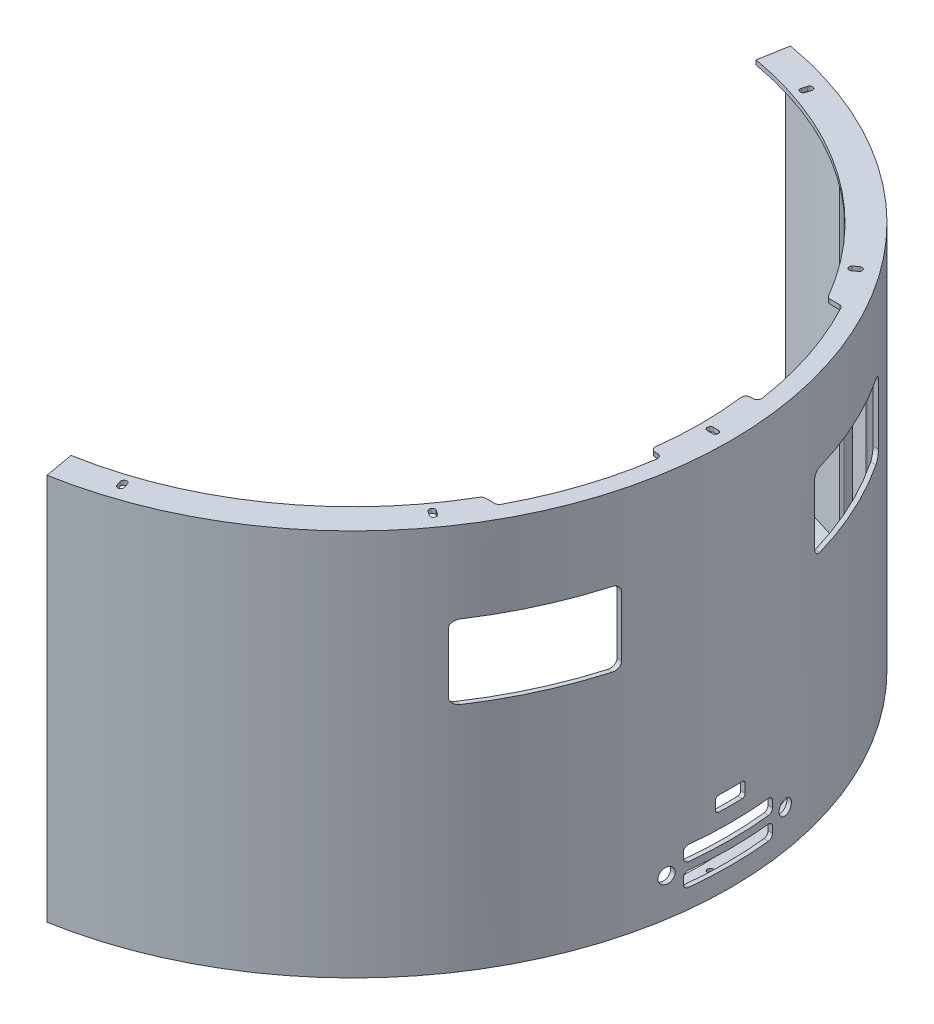
from build123d import *

# Parameters (mm, degrees)
BOSS_EXTRUDE1_DEPTH   = 255
BOSS_EXTRUDE2_DEPTH   = 255
BOSS_EXTRUDE2_2_DEPTH = 255
BOSS_EXTRUDE2_3_DEPTH = 255
BOSS_EXTRUDE2_4_DEPTH = 255
BOSS_EXTRUDE2_5_DEPTH = 255
BOSS_EXTRUDE2_6_DEPTH = 255
BOSS_EXTRUDE2_7_DEPTH = 255
BOSS_EXTRUDE2_8_DEPTH = 255
BOSS_EXTRUDE3_DEPTH   = 3
CUT_EXTRUDE3_DEPTH    = 5
LPATTERN1_COUNT       = 2
LPATTERN1_PITCH       = 258
LPATTERN2_COUNT       = 2
LPATTERN2_PITCH       = 258
CUT_EXTRUDE7_DEPTH    = 324
CUT_EXTRUDE10_DEPTH   = 5
FILLET2_R             = 3
CUT_EXTRUDE11_DEPTH   = 317
SKETCH15_R            = 5
CUT_EXTRUDE12_DEPTH   = 368


with BuildPart() as part:
    # Sketch3 → Boss-Extrude1 (new body)
    with BuildSketch(Plane(origin=(0, 0, 0), x_dir=(1, 0, 0), z_dir=(0, 1, 0))):
        with BuildLine():
            ThreePointArc((0, -254.5), (-22.181136529, -253.531550664), (-44.193461216, -250.633573142))
            Line((-44.193461216, -250.633573142), (-43.672516683, -247.679149883))
            ThreePointArc((-43.672516683, -247.679149883), (-21.919669301, -250.54296657), (0, -251.5))
            ThreePointArc((0, -251.5), (251.5, 0), (0, 251.5))
            ThreePointArc((0, 251.5), (-21.919669301, 250.54296657), (-43.672516683, 247.679149883))
            Line((-43.672516683, 247.679149883), (-44.193461216, 250.633573142))
            ThreePointArc((-44.193461216, 250.633573142), (-22.181136529, 253.531550664), (0, 254.5))
            ThreePointArc((0, 254.5), (254.5, 0), (0, -254.5))
        make_face()
    extrude(amount=BOSS_EXTRUDE1_DEPTH)


with BuildPart() as body_2:
    # Sketch6 → Boss-Extrude2 (new body)
    with BuildSketch(Plane(origin=(0, 255, 0), x_dir=(1, 0, 0), z_dir=(0, 1, 0))):
        with BuildLine():
            Line((-2, -253.081926056), (2, -253.081926056))
            Line((2, -253.081926056), (2, -247.081926056))
            ThreePointArc((2, -247.081926056), (1.707106781, -246.374819275), (1, -246.081926056))
            Line((1, -246.081926056), (-1, -246.081926056))
            ThreePointArc((-1, -246.081926056), (-1.707106781, -246.374819275), (-2, -247.081926056))
            Line((-2, -247.081926056), (-2, -253.081926056))
        make_face()
    extrude(amount=-BOSS_EXTRUDE2_DEPTH)


with BuildPart() as body_3:
    # Sketch6 → Boss-Extrude2 2 (new body)
    with BuildSketch(Plane(origin=(0, 255, 0), x_dir=(1, 0, 0), z_dir=(0, 1, 0))):
        with BuildLine():
            Line((-1, 246.081926056), (1, 246.081926056))
            ThreePointArc((1, 246.081926056), (1.707106781, 246.374819275), (2, 247.081926056))
            Line((2, 247.081926056), (2, 253.081926056))
            Line((2, 253.081926056), (-2, 253.081926056))
            Line((-2, 253.081926056), (-2, 247.081926056))
            ThreePointArc((-2, 247.081926056), (-1.707106781, 246.374819275), (-1, 246.081926056))
        make_face()
    extrude(amount=-BOSS_EXTRUDE2_2_DEPTH)


with BuildPart() as body_4:
    # Sketch6 → Boss-Extrude2 3 (new body)
    with BuildSketch(Plane(origin=(0, 255, 0), x_dir=(1, 0, 0), z_dir=(0, 1, 0))):
        with BuildLine():
            Line((111.610070116, 227.151168927), (108.006194645, 228.886703884))
            Line((108.006194645, 228.886703884), (105.40289221, 223.480890676))
            ThreePointArc((105.40289221, 223.480890676), (105.359977747, 222.716727875), (105.869977339, 222.146038069))
            Line((105.869977339, 222.146038069), (107.671915074, 221.278270591))
            ThreePointArc((107.671915074, 221.278270591), (108.436077876, 221.235356129), (109.006767681, 221.74535572))
            Line((109.006767681, 221.74535572), (111.610070116, 227.151168927))
        make_face()
    extrude(amount=-BOSS_EXTRUDE2_3_DEPTH)


with BuildPart() as body_5:
    # Sketch6 → Boss-Extrude2 4 (new body)
    with BuildSketch(Plane(origin=(0, 255, 0), x_dir=(1, 0, 0), z_dir=(0, 1, 0))):
        with BuildLine():
            Line((199.114397038, 156.230336966), (196.620437831, 159.357662896))
            Line((196.620437831, 159.357662896), (191.929448936, 155.616724085))
            ThreePointArc((191.929448936, 155.616724085), (191.559226528, 154.946857078), (191.771107255, 154.2114028))
            Line((191.771107255, 154.2114028), (193.018086859, 152.647739835))
            ThreePointArc((193.018086859, 152.647739835), (193.687953865, 152.277517427), (194.423408143, 152.489398155))
            Line((194.423408143, 152.489398155), (199.114397038, 156.230336966))
        make_face()
    extrude(amount=-BOSS_EXTRUDE2_4_DEPTH)


with BuildPart() as body_6:
    # Sketch6 → Boss-Extrude2 5 (new body)
    with BuildSketch(Plane(origin=(0, 255, 0), x_dir=(1, 0, 0), z_dir=(0, 1, 0))):
        with BuildLine():
            Line((247.181675649, 54.366170729), (246.291591913, 58.265882378))
            Line((246.291591913, 58.265882378), (240.44202444, 56.930756774))
            ThreePointArc((240.44202444, 56.930756774), (239.817821175, 56.487860938), (239.689617462, 55.733307928))
            Line((239.689617462, 55.733307928), (240.13465933, 53.783452104))
            ThreePointArc((240.13465933, 53.783452104), (240.577555165, 53.159248838), (241.332108176, 53.031045125))
            Line((241.332108176, 53.031045125), (247.181675649, 54.366170729))
        make_face()
    extrude(amount=-BOSS_EXTRUDE2_5_DEPTH)


with BuildPart() as body_7:
    # Sketch6 → Boss-Extrude2 6 (new body)
    with BuildSketch(Plane(origin=(0, 255, 0), x_dir=(1, 0, 0), z_dir=(0, 1, 0))):
        with BuildLine():
            Line((246.291591913, -58.265882378), (247.181675649, -54.366170729))
            Line((247.181675649, -54.366170729), (241.332108176, -53.031045125))
            ThreePointArc((241.332108176, -53.031045125), (240.577555165, -53.159248838), (240.13465933, -53.783452104))
            Line((240.13465933, -53.783452104), (239.689617462, -55.733307928))
            ThreePointArc((239.689617462, -55.733307928), (239.817821175, -56.487860938), (240.44202444, -56.930756774))
            Line((240.44202444, -56.930756774), (246.291591913, -58.265882378))
        make_face()
    extrude(amount=-BOSS_EXTRUDE2_6_DEPTH)


with BuildPart() as body_8:
    # Sketch6 → Boss-Extrude2 7 (new body)
    with BuildSketch(Plane(origin=(0, 255, 0), x_dir=(1, 0, 0), z_dir=(0, 1, 0))):
        with BuildLine():
            Line((196.620437831, -159.357662896), (199.114397038, -156.230336966))
            Line((199.114397038, -156.230336966), (194.423408143, -152.489398155))
            ThreePointArc((194.423408143, -152.489398155), (193.687953865, -152.277517427), (193.018086859, -152.647739835))
            Line((193.018086859, -152.647739835), (191.771107255, -154.2114028))
            ThreePointArc((191.771107255, -154.2114028), (191.559226528, -154.946857078), (191.929448936, -155.616724085))
            Line((191.929448936, -155.616724085), (196.620437831, -159.357662896))
        make_face()
    extrude(amount=-BOSS_EXTRUDE2_7_DEPTH)


with BuildPart() as body_9:
    # Sketch6 → Boss-Extrude2 8 (new body)
    with BuildSketch(Plane(origin=(0, 255, 0), x_dir=(1, 0, 0), z_dir=(0, 1, 0))):
        with BuildLine():
            Line((108.006194645, -228.886703884), (111.610070116, -227.151168927))
            Line((111.610070116, -227.151168927), (109.006767681, -221.74535572))
            ThreePointArc((109.006767681, -221.74535572), (108.436077876, -221.235356129), (107.671915074, -221.278270591))
            Line((107.671915074, -221.278270591), (105.869977339, -222.146038069))
            ThreePointArc((105.869977339, -222.146038069), (105.359977747, -222.716727875), (105.40289221, -223.480890676))
            Line((105.40289221, -223.480890676), (108.006194645, -228.886703884))
        make_face()
    extrude(amount=-BOSS_EXTRUDE2_8_DEPTH)


with BuildPart() as body_3_1:
    add(body_3.part)

    # Combine2: union part, body 4, body 5, body 6, body 7, body 8, body 9, body 2
    add(part.part)
    add(body_4.part)
    add(body_5.part)
    add(body_6.part)
    add(body_7.part)
    add(body_8.part)
    add(body_9.part)
    add(body_2.part)

    # Sketch7 → Boss-Extrude3 (add)
    with BuildSketch(Plane(origin=(0, 255, 0), x_dir=(1, 0, 0), z_dir=(0, 1, 0))):
        with BuildLine():
            ThreePointArc((-44.193461216, 250.633573142), (254.5, 0), (-44.193461216, -250.633573142))
            Line((-44.193461216, -250.633573142), (-40.720497663, -230.937418081))
            ThreePointArc((-40.720497663, -230.937418081), (234.5, 0), (-40.720497663, 230.937418081))
            Line((-40.720497663, 230.937418081), (-44.193461216, 250.633573142))
        make_face()
    boss_extrude3 = extrude(amount=BOSS_EXTRUDE3_DEPTH)

    # Sketch8 → Cut-Extrude3 (cut)
    with BuildSketch(Plane.XZ.offset(-255)):
        with BuildLine():
            Line((240.8, 2), (244.2, 2))
            ThreePointArc((244.2, 2), (246.2, 0), (244.2, -2))
            Line((244.2, -2), (240.8, -2))
            ThreePointArc((240.8, -2), (238.8, 0), (240.8, 2))
        make_face()
        with BuildLine():
            Line((195.98686275, -139.920654763), (198.737520531, -141.919124621))
            ThreePointArc((198.737520531, -141.919124621), (199.179984015, -144.712729114), (196.386379522, -145.155192599))
            Line((196.386379522, -145.155192599), (193.635721741, -143.156722741))
            ThreePointArc((193.635721741, -143.156722741), (193.193258257, -140.363118247), (195.98686275, -139.920654763))
        make_face()
        with BuildLine():
            Line((76.313405278, -228.396375135), (77.364063059, -231.629967291))
            ThreePointArc((77.364063059, -231.629967291), (76.079984015, -234.150114312), (73.559836994, -232.866035268))
            Line((73.559836994, -232.866035268), (72.509179213, -229.632443113))
            ThreePointArc((72.509179213, -229.632443113), (73.793258257, -227.112296091), (76.313405278, -228.396375135))
        make_face()
        with BuildLine():
            Line((-72.509179213, -229.632443113), (-73.559836994, -232.866035268))
            ThreePointArc((-73.559836994, -232.866035268), (-76.079984015, -234.150114312), (-77.364063059, -231.629967291))
            Line((-77.364063059, -231.629967291), (-76.313405278, -228.396375135))
            ThreePointArc((-76.313405278, -228.396375135), (-73.793258257, -227.112296091), (-72.509179213, -229.632443113))
        make_face()
        with BuildLine():
            Line((-193.635721741, -143.156722741), (-196.386379522, -145.155192599))
            ThreePointArc((-196.386379522, -145.155192599), (-199.179984015, -144.712729114), (-198.737520531, -141.919124621))
            Line((-198.737520531, -141.919124621), (-195.98686275, -139.920654763))
            ThreePointArc((-195.98686275, -139.920654763), (-193.193258257, -140.363118247), (-193.635721741, -143.156722741))
        make_face()
        with BuildLine():
            Line((-240.8, -2), (-244.2, -2))
            ThreePointArc((-244.2, -2), (-246.2, 0), (-244.2, 2))
            Line((-244.2, 2), (-240.8, 2))
            ThreePointArc((-240.8, 2), (-238.8, 0), (-240.8, -2))
        make_face()
        with BuildLine():
            Line((-195.98686275, 139.920654763), (-198.737520531, 141.919124621))
            ThreePointArc((-198.737520531, 141.919124621), (-199.179984015, 144.712729114), (-196.386379522, 145.155192599))
            Line((-196.386379522, 145.155192599), (-193.635721741, 143.156722741))
            ThreePointArc((-193.635721741, 143.156722741), (-193.193258257, 140.363118247), (-195.98686275, 139.920654763))
        make_face()
        with BuildLine():
            Line((-76.313405278, 228.396375135), (-77.364063059, 231.629967291))
            ThreePointArc((-77.364063059, 231.629967291), (-76.079984015, 234.150114312), (-73.559836994, 232.866035268))
            Line((-73.559836994, 232.866035268), (-72.509179213, 229.632443113))
            ThreePointArc((-72.509179213, 229.632443113), (-73.793258257, 227.112296091), (-76.313405278, 228.396375135))
        make_face()
        with BuildLine():
            Line((72.509179213, 229.632443113), (73.559836994, 232.866035268))
            ThreePointArc((73.559836994, 232.866035268), (76.079984015, 234.150114312), (77.364063059, 231.629967291))
            Line((77.364063059, 231.629967291), (76.313405278, 228.396375135))
            ThreePointArc((76.313405278, 228.396375135), (73.793258257, 227.112296091), (72.509179213, 229.632443113))
        make_face()
        with BuildLine():
            Line((193.635721741, 143.156722741), (196.386379522, 145.155192599))
            ThreePointArc((196.386379522, 145.155192599), (199.179984015, 144.712729114), (198.737520531, 141.919124621))
            Line((198.737520531, 141.919124621), (195.98686275, 139.920654763))
            ThreePointArc((195.98686275, 139.920654763), (193.193258257, 140.363118247), (193.635721741, 143.156722741))
        make_face()
    cut_extrude3 = extrude(amount=-CUT_EXTRUDE3_DEPTH, mode=Mode.SUBTRACT)

    # LPattern1: Boss-Extrude3 ×2
    with Locations(*[(0, -i * LPATTERN1_PITCH, 0) for i in range(1, LPATTERN1_COUNT)]):
        add(boss_extrude3)

    # LPattern2: Cut-Extrude3 ×2
    with Locations(*[(0, -i * LPATTERN2_PITCH, 0) for i in range(1, LPATTERN2_COUNT)]):
        add(cut_extrude3, mode=Mode.SUBTRACT)

    # Sketch11 → Cut-Extrude7 (cut)
    with BuildSketch(Plane(origin=(0, 258, 0), x_dir=(1, 0, 0), z_dir=(0, 1, 0))):
        with BuildLine():
            Line((-44.193461216, 250.633573142), (0, 0))
            Line((0, 0), (44.193461216, 250.633573142))
            ThreePointArc((44.193461216, 250.633573142), (0, 254.5), (-44.193461216, 250.633573142))
        make_face()
    cut_extrude7 = extrude(amount=-CUT_EXTRUDE7_DEPTH, mode=Mode.SUBTRACT)

    # Mirror1: Cut-Extrude7 across plane
    add(cut_extrude7.mirror(Plane.XY), mode=Mode.SUBTRACT)

    # Sketch13 → Cut-Extrude10 (cut)
    with BuildSketch(Plane(origin=(0, 258, 0), x_dir=(1, 0, 0), z_dir=(0, 1, 0))):
        with BuildLine():
            Line((240.8, 32.135476301), (189.842924972, 32.135476301))
            Line((189.842924972, 32.135476301), (189.842924972, 116.171040312))
            Line((189.842924972, 116.171040312), (213.357957972, 116.171040312))
            ThreePointArc((213.357957972, 116.171040312), (230.93366299, 75.412015854), (240.8, 32.135476301))
        make_face()
        with BuildLine():
            Line((189.842924972, -116.171040312), (213.357957972, -116.171040312))
            ThreePointArc((213.357957972, -116.171040312), (230.93366299, -75.412015854), (240.8, -32.135476301))
            Line((240.8, -32.135476301), (189.842924972, -32.135476301))
            Line((189.842924972, -32.135476301), (189.842924972, -116.171040312))
        make_face()
    extrude(amount=-CUT_EXTRUDE10_DEPTH, mode=Mode.SUBTRACT)

    # Fillet2
    fillet2_edges = [body_3_1.edges().sort_by_distance(p)[0] for p in [
        (213.357957972, 256.5, -116.171040312),
        (232.287668986, 256.5, -32.135476301),
        (240.8, 256.5, -32.135476301),
        (203.702084901, 256.5, -116.171040312),
        (240.8, 256.5, 32.135476301),
        (203.702084901, 256.5, 116.171040312),
        (213.357957972, 256.5, 116.171040312),
        (232.287668986, 256.5, 32.135476301),
    ]]
    fillet(fillet2_edges, radius=FILLET2_R)

    # Sketch14 → Cut-Extrude11 (cut)
    with BuildSketch(Plane(origin=(0, 0, 0), x_dir=(0, 0, -1), z_dir=(1, 0, 0))):
        with BuildLine():
            Line((-140, 153), (-70, 153))
            ThreePointArc((-70, 153), (-66.464466094, 154.464466094), (-65, 158))
            Line((-65, 158), (-65, 198))
            ThreePointArc((-65, 198), (-66.464466094, 201.535533906), (-70, 203))
            Line((-70, 203), (-140, 203))
            ThreePointArc((-140, 203), (-143.535533906, 201.535533906), (-145, 198))
            Line((-145, 198), (-145, 158))
            ThreePointArc((-145, 158), (-143.535533906, 154.464466094), (-140, 153))
        make_face()
    cut_extrude11 = extrude(amount=CUT_EXTRUDE11_DEPTH, mode=Mode.SUBTRACT)

    # Mirror2: Cut-Extrude11 across plane
    add(cut_extrude11.mirror(Plane.XY), mode=Mode.SUBTRACT)

    # Sketch15 → Cut-Extrude12 (cut)
    with BuildSketch(Plane(origin=(0, 0, 0), x_dir=(0, 0, -1), z_dir=(1, 0, 0))):
        with Locations(Location((40, 22.5, 0), (0, 0, 180))):
            Circle(SKETCH15_R)
        with Locations(Location((-40, 22.5, 0), (0, 0, 180))):
            Circle(SKETCH15_R)
        with BuildLine():
            Line((-27, 10), (27, 10))
            ThreePointArc((27, 10), (29.121320344, 10.878679656), (30, 13))
            Line((30, 13), (30, 17))
            ThreePointArc((30, 17), (29.121320344, 19.121320344), (27, 20))
            Line((27, 20), (-27, 20))
            ThreePointArc((-27, 20), (-29.121320344, 19.121320344), (-30, 17))
            Line((-30, 17), (-30, 13))
            ThreePointArc((-30, 13), (-29.121320344, 10.878679656), (-27, 10))
        make_face()
        with BuildLine():
            Line((-27, 25), (27, 25))
            ThreePointArc((27, 25), (29.121320344, 25.878679656), (30, 28))
            Line((30, 28), (30, 32))
            ThreePointArc((30, 32), (29.121320344, 34.121320344), (27, 35))
            Line((27, 35), (-27, 35))
            ThreePointArc((-27, 35), (-29.121320344, 34.121320344), (-30, 32))
            Line((-30, 32), (-30, 28))
            ThreePointArc((-30, 28), (-29.121320344, 25.878679656), (-27, 25))
        make_face()
        with BuildLine():
            Line((-8, 45), (8, 45))
            ThreePointArc((8, 45), (9.414213562, 45.585786438), (10, 47))
            Line((10, 47), (10, 53))
            ThreePointArc((10, 53), (9.414213562, 54.414213562), (8, 55))
            Line((8, 55), (-8, 55))
            ThreePointArc((-8, 55), (-9.414213562, 54.414213562), (-10, 53))
            Line((-10, 53), (-10, 47))
            ThreePointArc((-10, 47), (-9.414213562, 45.585786438), (-8, 45))
        make_face()
    extrude(amount=CUT_EXTRUDE12_DEPTH, mode=Mode.SUBTRACT)


solid = body_3_1.part
